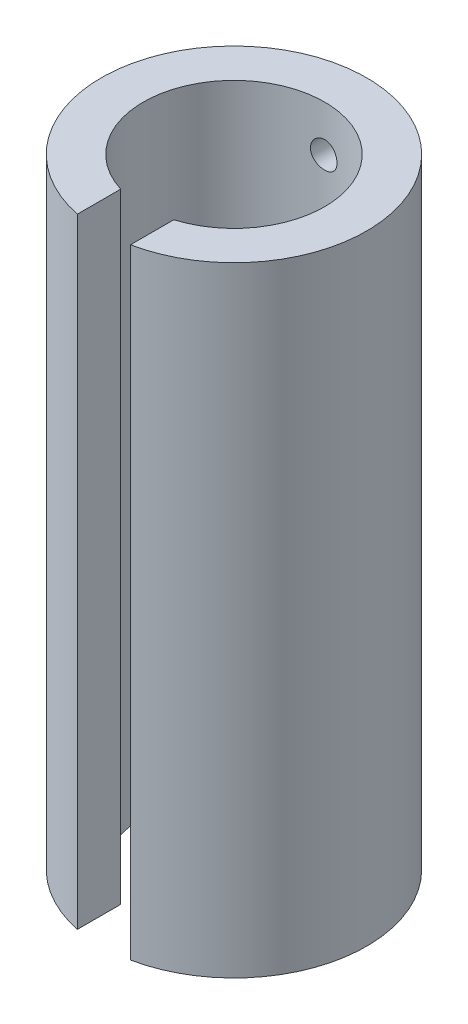
from build123d import *

# Parameters (mm, degrees)
SKETCH_1_R               = 15
SKETCH_1_R_2             = 10.25
EXTRUDE_1_DEPTH          = 150
CUT_EXTRUDE_1_DEPTH      = 154.703965854
CUT_EXTRUDE_1_DEPTH_BACK = 154.703965854
SKETCH_2_R               = 1.5
SKETCH_3_R               = 22.14266171
CUT_EXTRUDE_2_DEPTH      = 80
SKETCH_5_W               = 6
SKETCH_5_H               = 5.980913868
CUT_EXTRUDE_3_DEPTH      = 80


with BuildPart() as part:
    # 스케치1 → 보스-돌출1 (new body)
    with BuildSketch(Plane(origin=(0, 0, 0), x_dir=(1, 0, 0), z_dir=(0, 1, 0))):
        with Locations(Location((0, 0, 0), (0, 0, 270))):
            Circle(SKETCH_1_R)
        with Locations(Location((0, 0, 0), (0, 0, 270))):
            Circle(SKETCH_1_R_2, mode=Mode.SUBTRACT)
    extrude(amount=EXTRUDE_1_DEPTH)

    # 스케치2 → 컷-돌출1 (cut, two sides: drawn at the far end of the back side and taken through both)
    with BuildSketch(Plane(origin=(0, 0, -14.998485281), x_dir=(-1, 0, 0), z_dir=(0, 0, -1)).offset(-CUT_EXTRUDE_1_DEPTH_BACK)):
        with Locations(Location((0, 11.805761924, 0), (0, 0, 90))):
            Circle(SKETCH_2_R)
        with Locations(Location((0, 21.207864132, 0), (0, 0, 90))):
            Circle(SKETCH_2_R)
        with Locations(Location((0, 36.207864132, 0), (0, 0, 90))):
            Circle(SKETCH_2_R)
        with Locations(Location((0, 48.906437248, 0), (0, 0, 90))):
            Circle(SKETCH_2_R)
        with Locations(Location((0, 56.868147497, 0), (0, 0, 90))):
            Circle(SKETCH_2_R)
        with Locations(Location((0, 64.829857746, 0), (0, 0, 90))):
            Circle(SKETCH_2_R)
        with Locations(Location((0, 77.054405077, 0), (0, 0, 90))):
            Circle(SKETCH_2_R)
        with Locations(Location((0, 91.899672592, 0), (0, 0, 90))):
            Circle(SKETCH_2_R)
        with Locations(Location((0, 106.761531723, 0), (0, 0, 90))):
            Circle(SKETCH_2_R)
        with Locations(Location((0, 122.331098432, 0), (0, 0, 90))):
            Circle(SKETCH_2_R)
        with Locations(Location((0, 136.839103775, 0), (0, 0, 90))):
            Circle(SKETCH_2_R)
    extrude(amount=CUT_EXTRUDE_1_DEPTH + CUT_EXTRUDE_1_DEPTH_BACK, mode=Mode.SUBTRACT)

    # 스케치3 → 컷-돌출2 (cut)
    with BuildSketch(Plane(origin=(0, 150, 0), x_dir=(1, 0, 0), z_dir=(0, 1, 0))):
        Circle(SKETCH_3_R)
    extrude(amount=-CUT_EXTRUDE_2_DEPTH, mode=Mode.SUBTRACT)

    # 스케치5 → 컷-돌출3 (cut)
    with BuildSketch(Plane.XZ):
        with Locations((0, 12.107840203)):
            Rectangle(SKETCH_5_W, SKETCH_5_H)
    extrude(amount=-CUT_EXTRUDE_3_DEPTH, mode=Mode.SUBTRACT)


solid = part.part
